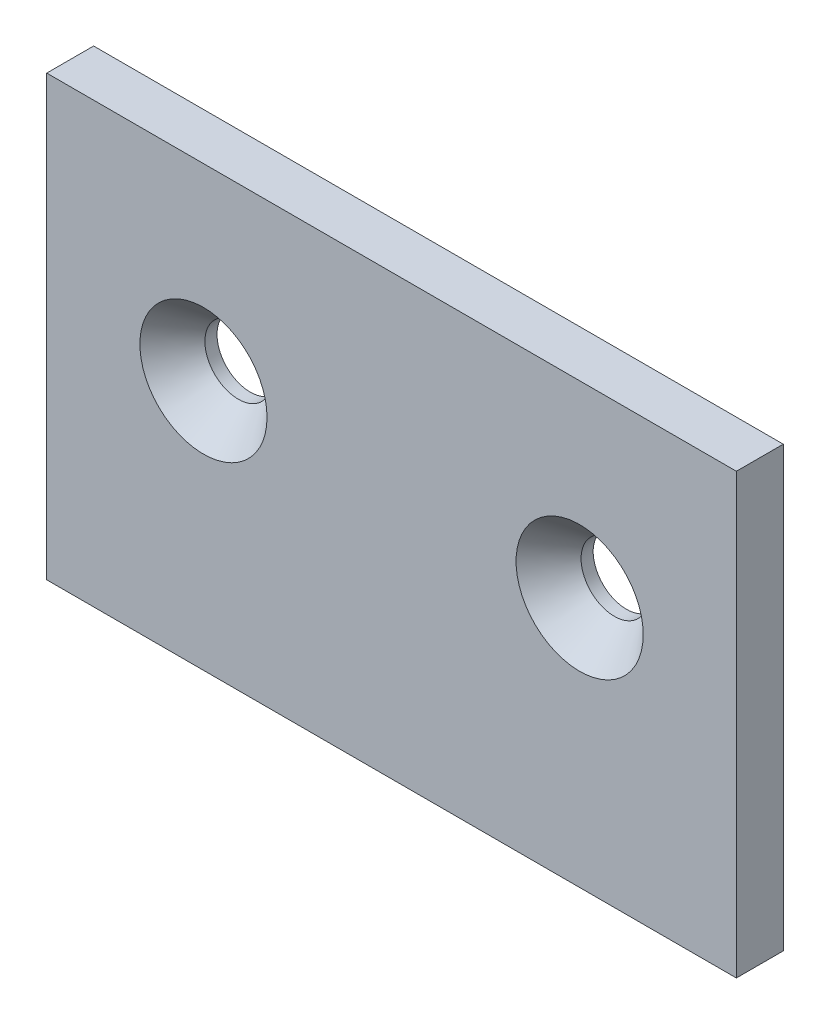
from build123d import *

# Parameters (mm, degrees)
SKETCH2_W                                     = 69.85
SKETCH2_H                                     = 44.45
BOSS_EXTRUDE1_DEPTH                           = 4.7498
CSK_FOR_1_4_FLAT_HEAD_MACHINE_SCREW5_AT_COUNT = 2
CSK_FOR_1_4_FLAT_HEAD_MACHINE_SCREW5_AT_PITCH = 38.1


with BuildPart() as part:
    # Sketch2 → Boss-Extrude1 (new body)
    with BuildSketch(Plane.XY):
        with Locations((0, 22.225)):
            Rectangle(SKETCH2_W, SKETCH2_H)
    extrude(amount=-BOSS_EXTRUDE1_DEPTH)

    # Sketch14 → CSK for 1/4 Flat Head Machine Screw5 (revolve, cut)
    with BuildSketch(Plane(origin=(-19.05, 25.4, 0), x_dir=(0, -1, 0), z_dir=(1, 0, 0))):
        Polygon((0, 0), (0, 4.7498), (3.3782, 4.7498), (3.3782, 3.520932584), (6.4389, 0), align=None)
    csk_for_1_4_flat_head_machine_screw5 = revolve(axis=Axis((-19.05, 25.4, 6.35), (0, 0, -1)), mode=Mode.SUBTRACT)

    # CSK for 1/4 Flat Head Machine Screw5 at: CSK for 1/4 Flat Head Machine Screw5 ×2
    with Locations(*[(i * CSK_FOR_1_4_FLAT_HEAD_MACHINE_SCREW5_AT_PITCH, 0, 0) for i in range(1, CSK_FOR_1_4_FLAT_HEAD_MACHINE_SCREW5_AT_COUNT)]):
        add(csk_for_1_4_flat_head_machine_screw5, mode=Mode.SUBTRACT)


solid = part.part
